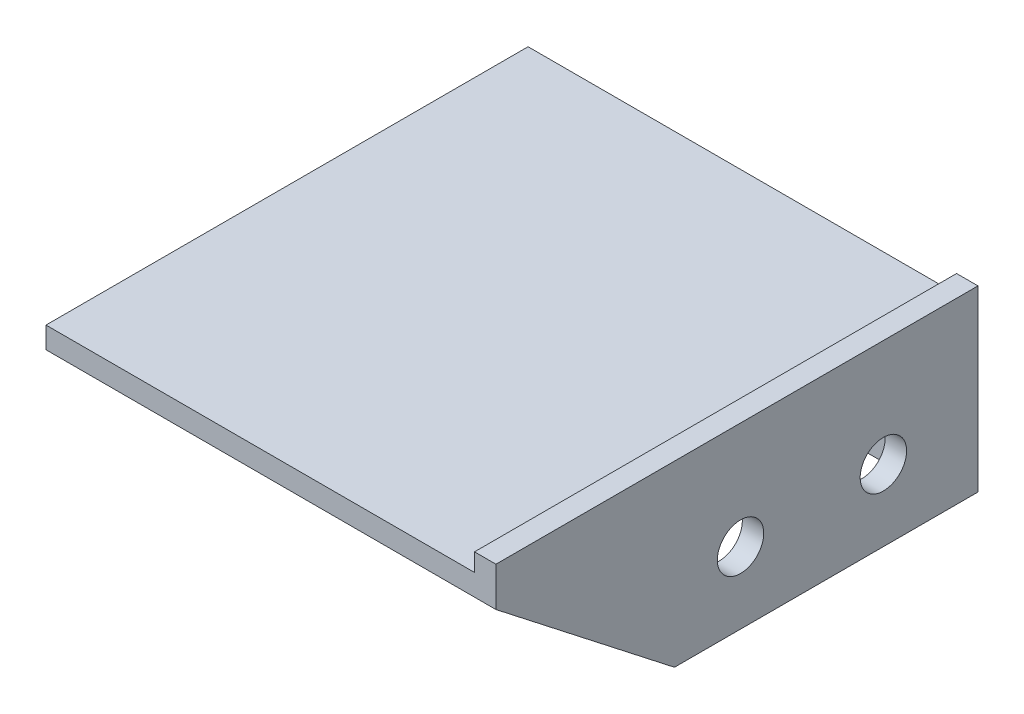
from build123d import *

# Parameters (mm, degrees)
SKETCH_2_W          = 240
SKETCH_2_H          = 270
EXTRUDE_1_DEPTH     = 12
SKETCH_3_W          = 270
SKETCH_3_H          = 100
EXTRUDE_2_DEPTH     = 12
SKETCH_4_W          = 12
SKETCH_4_H          = 78
EXTRUDE_3_DEPTH     = 240
SKETCH_5_R          = 13
CUT_EXTRUDE_1_DEPTH = 369.987804677
SKETCH_6_R          = 13
CUT_EXTRUDE_2_DEPTH = 378.475827041


with BuildPart() as part:
    # 草图2 → 凸台-拉伸1 (new body)
    with BuildSketch(Plane(origin=(0, 0, 0), x_dir=(1, 0, 0), z_dir=(0, 1, 0))):
        with Locations((120, 135)):
            Rectangle(SKETCH_2_W, SKETCH_2_H)
    extrude(amount=EXTRUDE_1_DEPTH)

    # 草图3 → 凸台-拉伸2 (add)
    with BuildSketch(Plane(origin=(240, 0, 0), x_dir=(0, 0, -1), z_dir=(1, 0, 0))):
        with Locations((135, -28)):
            Rectangle(SKETCH_3_W, SKETCH_3_H)
    extrude(amount=EXTRUDE_2_DEPTH)

    # 草图4 → 凸台-拉伸3 (add)
    with BuildSketch(Plane.ZY.offset(-240)):
        with Locations((-264, -39)):
            Rectangle(SKETCH_4_W, SKETCH_4_H)
    extrude(amount=EXTRUDE_3_DEPTH)

    # 草图5 → 切除-拉伸1 (cut, through all)
    with BuildSketch(Plane.XY.offset(-258)):
        with Locations((38, -38)):
            Circle(SKETCH_5_R)
        with Locations((158, -38)):
            Circle(SKETCH_5_R)
    extrude(amount=-CUT_EXTRUDE_1_DEPTH, mode=Mode.SUBTRACT)

    # 草图6 → 切除-拉伸2 (cut, through all)
    with BuildSketch(Plane(origin=(252, 0, 0), x_dir=(0, 0, -1), z_dir=(1, 0, 0))):
        with Locations((137, -38)):
            Circle(SKETCH_6_R)
        with Locations((217, -38)):
            Circle(SKETCH_6_R)
        Polygon((0, 0), (100, -78), (0, -78), align=None)
    extrude(amount=-CUT_EXTRUDE_2_DEPTH, mode=Mode.SUBTRACT)


solid = part.part
